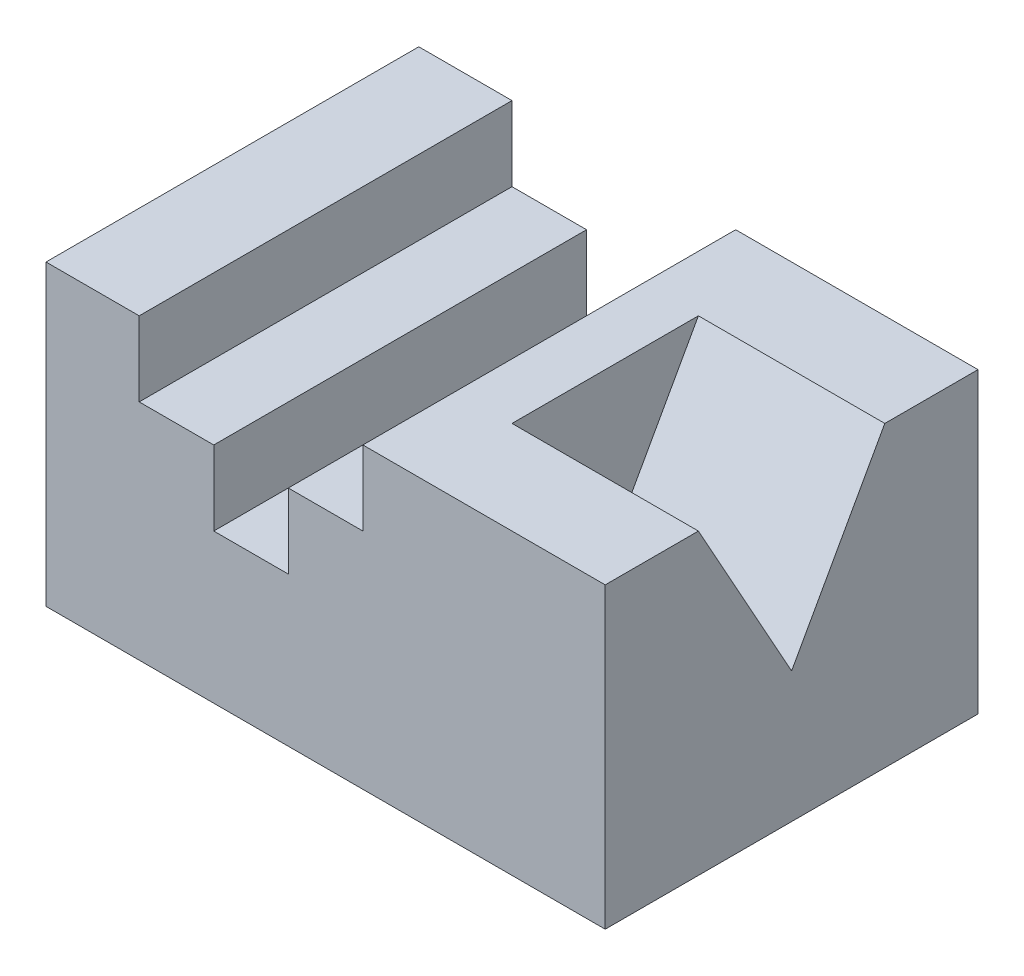
from build123d import *

# Parameters (mm, degrees)
BOSS_EXTRUDE1_DEPTH = 100
CUT_EXTRUDE1_DEPTH  = 50


with BuildPart() as part:
    # Sketch1 → Boss-Extrude1 (new body)
    with BuildSketch(Plane.XY):
        Polygon((25, 80), (0, 80), (0, 0), (150, 0), (150, 80), (85, 80), (85, 60), (65, 60), (65, 40), (45, 40), (45, 60), (25, 60), align=None)
    extrude(amount=-BOSS_EXTRUDE1_DEPTH)

    # Sketch2 → Cut-Extrude1 (cut)
    with BuildSketch(Plane(origin=(150, 0, 0), x_dir=(0, 0, -1), z_dir=(1, 0, 0))):
        Polygon((25, 80), (50, 35), (75, 80), align=None)
    extrude(amount=-CUT_EXTRUDE1_DEPTH, mode=Mode.SUBTRACT)


solid = part.part
